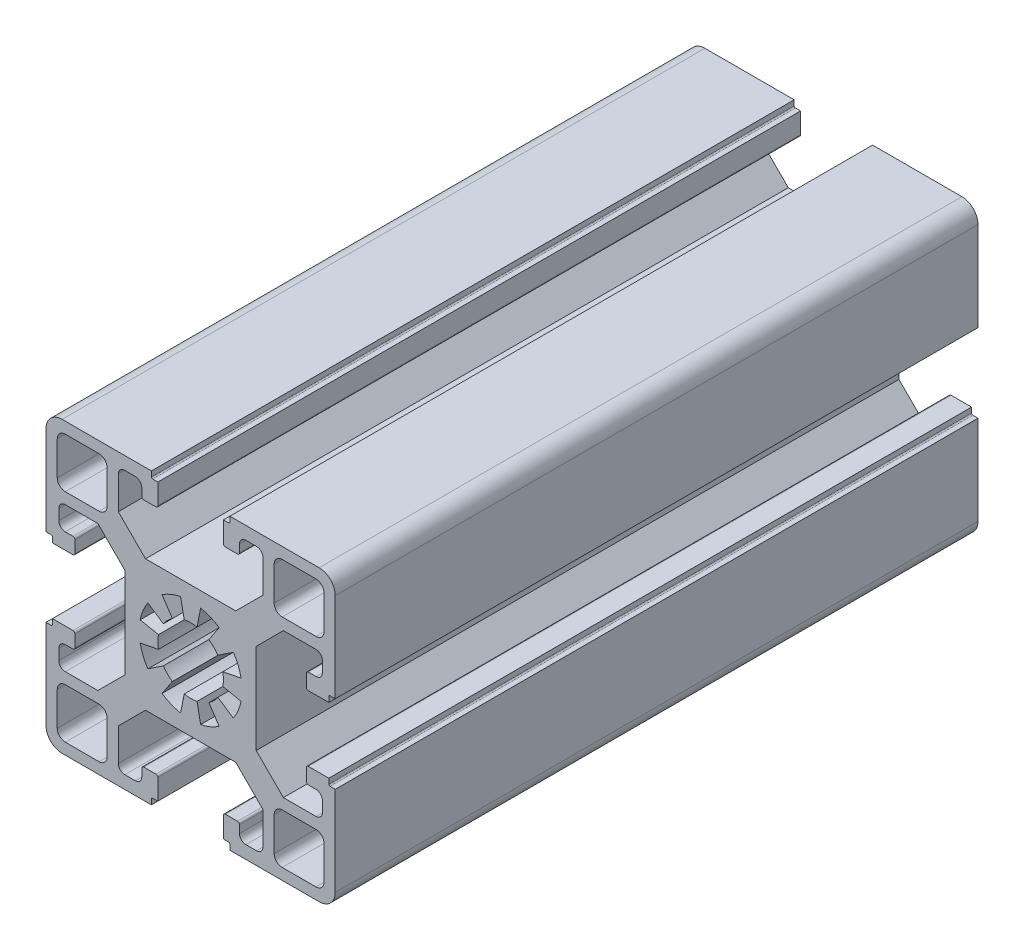
from build123d import *

# Parameters (mm, degrees)
EXTRUDE_1_DEPTH = 100


with BuildPart() as part:
    # 草图1 → 凸台-拉伸1 (new body)
    with BuildSketch(Plane.XY):
        with BuildLine():
            Line((-7.794028247, 21.742987377), (-21.694028247, 21.742987377))
            ThreePointArc((-21.694028247, 21.742987377), (-23.4617952, 21.01075433), (-24.194028247, 19.242987377))
            Line((-24.194028247, 19.242987377), (-24.194028247, 5.342987377))
            Line((-24.194028247, 5.342987377), (-23.394028247, 5.342987377))
            ThreePointArc((-23.394028247, 5.342987377), (-23.252606891, 5.284408734), (-23.194028247, 5.142987377))
            Line((-23.194028247, 5.142987377), (-23.194028247, 4.342987377))
            Line((-23.194028247, 4.342987377), (-19.994028247, 4.342987377))
            ThreePointArc((-19.994028247, 4.342987377), (-19.781896213, 4.430855343), (-19.694028247, 4.642987377))
            Line((-19.694028247, 4.642987377), (-19.694028247, 6.542987377))
            ThreePointArc((-19.694028247, 6.542987377), (-19.781896213, 6.755119412), (-19.994028247, 6.842987377))
            Line((-19.994028247, 6.842987377), (-21.194028247, 6.842987377))
            ThreePointArc((-21.194028247, 6.842987377), (-21.901135028, 7.135880596), (-22.194028247, 7.842987377))
            Line((-22.194028247, 7.842987377), (-22.194028247, 9.492987377))
            ThreePointArc((-22.194028247, 9.492987377), (-21.901135028, 10.200094158), (-21.194028247, 10.492987377))
            Line((-21.194028247, 10.492987377), (-16.126008762, 10.492987377))
            Line((-16.126008762, 10.492987377), (-11.894028247, 6.261006862))
            Line((-11.894028247, 6.261006862), (-11.894028247, -7.775032107))
            Line((-11.894028247, -7.775032107), (-16.126008762, -12.007012623))
            Line((-16.126008762, -12.007012623), (-21.194028247, -12.007012623))
            ThreePointArc((-21.194028247, -12.007012623), (-21.901135028, -11.714119404), (-22.194028247, -11.007012623))
            Line((-22.194028247, -11.007012623), (-22.194028247, -9.357012623))
            ThreePointArc((-22.194028247, -9.357012623), (-21.901135028, -8.649905842), (-21.194028247, -8.357012623))
            Line((-21.194028247, -8.357012623), (-19.994028247, -8.357012623))
            ThreePointArc((-19.994028247, -8.357012623), (-19.781896213, -8.269144657), (-19.694028247, -8.057012623))
            Line((-19.694028247, -8.057012623), (-19.694028247, -6.157012623))
            ThreePointArc((-19.694028247, -6.157012623), (-19.781896213, -5.944880588), (-19.994028247, -5.857012623))
            Line((-19.994028247, -5.857012623), (-23.194028247, -5.857012623))
            Line((-23.194028247, -5.857012623), (-23.194028247, -6.657012623))
            ThreePointArc((-23.194028247, -6.657012623), (-23.252606891, -6.798433979), (-23.394028247, -6.857012623))
            Line((-23.394028247, -6.857012623), (-24.194028247, -6.857012623))
            Line((-24.194028247, -6.857012623), (-24.194028247, -20.757012623))
            ThreePointArc((-24.194028247, -20.757012623), (-23.4617952, -22.524779576), (-21.694028247, -23.257012623))
            Line((-21.694028247, -23.257012623), (-7.794028247, -23.257012623))
            Line((-7.794028247, -23.257012623), (-7.794028247, -22.457012623))
            ThreePointArc((-7.794028247, -22.457012623), (-7.735449603, -22.315591266), (-7.594028247, -22.257012623))
            Line((-7.594028247, -22.257012623), (-6.794028247, -22.257012623))
            Line((-6.794028247, -22.257012623), (-6.794028247, -19.057012623))
            ThreePointArc((-6.794028247, -19.057012623), (-6.881896213, -18.844880588), (-7.094028247, -18.757012623))
            Line((-7.094028247, -18.757012623), (-8.994028247, -18.757012623))
            ThreePointArc((-8.994028247, -18.757012623), (-9.206160281, -18.844880588), (-9.294028247, -19.057012623))
            Line((-9.294028247, -19.057012623), (-9.294028247, -20.257012623))
            ThreePointArc((-9.294028247, -20.257012623), (-9.586921466, -20.964119404), (-10.294028247, -21.257012623))
            Line((-10.294028247, -21.257012623), (-11.944028247, -21.257012623))
            ThreePointArc((-11.944028247, -21.257012623), (-12.651135028, -20.964119404), (-12.944028247, -20.257012623))
            Line((-12.944028247, -20.257012623), (-12.944028247, -15.188993138))
            Line((-12.944028247, -15.188993138), (-8.712047732, -10.957012623))
            Line((-8.712047732, -10.957012623), (5.323991238, -10.957012623))
            Line((5.323991238, -10.957012623), (9.555971753, -15.188993138))
            Line((9.555971753, -15.188993138), (9.555971753, -20.257012623))
            ThreePointArc((9.555971753, -20.257012623), (9.263078534, -20.964119404), (8.555971753, -21.257012623))
            Line((8.555971753, -21.257012623), (6.905971753, -21.257012623))
            ThreePointArc((6.905971753, -21.257012623), (6.198864972, -20.964119404), (5.905971753, -20.257012623))
            Line((5.905971753, -20.257012623), (5.905971753, -19.057012623))
            ThreePointArc((5.905971753, -19.057012623), (5.818103787, -18.844880588), (5.605971753, -18.757012623))
            Line((5.605971753, -18.757012623), (3.705971753, -18.757012623))
            ThreePointArc((3.705971753, -18.757012623), (3.493839719, -18.844880588), (3.405971753, -19.057012623))
            Line((3.405971753, -19.057012623), (3.405971753, -22.257012623))
            Line((3.405971753, -22.257012623), (4.205971753, -22.257012623))
            ThreePointArc((4.205971753, -22.257012623), (4.347393109, -22.315591266), (4.405971753, -22.457012623))
            Line((4.405971753, -22.457012623), (4.405971753, -23.257012623))
            Line((4.405971753, -23.257012623), (18.305971753, -23.257012623))
            ThreePointArc((18.305971753, -23.257012623), (20.073738706, -22.524779576), (20.805971753, -20.757012623))
            Line((20.805971753, -20.757012623), (20.805971753, -6.857012623))
            Line((20.805971753, -6.857012623), (20.005971753, -6.857012623))
            ThreePointArc((20.005971753, -6.857012623), (19.864550397, -6.798433979), (19.805971753, -6.657012623))
            Line((19.805971753, -6.657012623), (19.805971753, -5.857012623))
            Line((19.805971753, -5.857012623), (16.605971753, -5.857012623))
            ThreePointArc((16.605971753, -5.857012623), (16.393839719, -5.944880588), (16.305971753, -6.157012623))
            Line((16.305971753, -6.157012623), (16.305971753, -8.057012623))
            ThreePointArc((16.305971753, -8.057012623), (16.393839719, -8.269144657), (16.605971753, -8.357012623))
            Line((16.605971753, -8.357012623), (17.805971753, -8.357012623))
            ThreePointArc((17.805971753, -8.357012623), (18.513078534, -8.649905842), (18.805971753, -9.357012623))
            Line((18.805971753, -9.357012623), (18.805971753, -11.007012623))
            ThreePointArc((18.805971753, -11.007012623), (18.513078534, -11.714119404), (17.805971753, -12.007012623))
            Line((17.805971753, -12.007012623), (12.737952268, -12.007012623))
            Line((12.737952268, -12.007012623), (8.505971753, -7.775032107))
            Line((8.505971753, -7.775032107), (8.505971753, 6.261006862))
            Line((8.505971753, 6.261006862), (12.737952268, 10.492987377))
            Line((12.737952268, 10.492987377), (17.805971753, 10.492987377))
            ThreePointArc((17.805971753, 10.492987377), (18.513078534, 10.200094158), (18.805971753, 9.492987377))
            Line((18.805971753, 9.492987377), (18.805971753, 7.842987377))
            ThreePointArc((18.805971753, 7.842987377), (18.513078534, 7.135880596), (17.805971753, 6.842987377))
            Line((17.805971753, 6.842987377), (16.605971753, 6.842987377))
            ThreePointArc((16.605971753, 6.842987377), (16.393839719, 6.755119412), (16.305971753, 6.542987377))
            Line((16.305971753, 6.542987377), (16.305971753, 4.642987377))
            ThreePointArc((16.305971753, 4.642987377), (16.393839719, 4.430855343), (16.605971753, 4.342987377))
            Line((16.605971753, 4.342987377), (19.805971753, 4.342987377))
            Line((19.805971753, 4.342987377), (19.805971753, 5.142987377))
            ThreePointArc((19.805971753, 5.142987377), (19.864550397, 5.284408734), (20.005971753, 5.342987377))
            Line((20.005971753, 5.342987377), (20.805971753, 5.342987377))
            Line((20.805971753, 5.342987377), (20.805971753, 19.242987377))
            ThreePointArc((20.805971753, 19.242987377), (20.073738706, 21.01075433), (18.305971753, 21.742987377))
            Line((18.305971753, 21.742987377), (4.405971753, 21.742987377))
            Line((4.405971753, 21.742987377), (4.405971753, 20.942987377))
            ThreePointArc((4.405971753, 20.942987377), (4.347393109, 20.801566021), (4.205971753, 20.742987377))
            Line((4.205971753, 20.742987377), (3.405971753, 20.742987377))
            Line((3.405971753, 20.742987377), (3.405971753, 17.542987377))
            ThreePointArc((3.405971753, 17.542987377), (3.493839719, 17.330855343), (3.705971753, 17.242987377))
            Line((3.705971753, 17.242987377), (5.605971753, 17.242987377))
            ThreePointArc((5.605971753, 17.242987377), (5.818103787, 17.330855343), (5.905971753, 17.542987377))
            Line((5.905971753, 17.542987377), (5.905971753, 18.742987377))
            ThreePointArc((5.905971753, 18.742987377), (6.198864972, 19.450094158), (6.905971753, 19.742987377))
            Line((6.905971753, 19.742987377), (8.555971753, 19.742987377))
            ThreePointArc((8.555971753, 19.742987377), (9.263078534, 19.450094158), (9.555971753, 18.742987377))
            Line((9.555971753, 18.742987377), (9.555971753, 13.674967893))
            Line((9.555971753, 13.674967893), (5.323991238, 9.442987377))
            Line((5.323991238, 9.442987377), (-8.712047732, 9.442987377))
            Line((-8.712047732, 9.442987377), (-12.944028247, 13.674967893))
            Line((-12.944028247, 13.674967893), (-12.944028247, 18.742987377))
            ThreePointArc((-12.944028247, 18.742987377), (-12.651135028, 19.450094158), (-11.944028247, 19.742987377))
            Line((-11.944028247, 19.742987377), (-10.294028247, 19.742987377))
            ThreePointArc((-10.294028247, 19.742987377), (-9.586921466, 19.450094158), (-9.294028247, 18.742987377))
            Line((-9.294028247, 18.742987377), (-9.294028247, 17.542987377))
            ThreePointArc((-9.294028247, 17.542987377), (-9.206160281, 17.330855343), (-8.994028247, 17.242987377))
            Line((-8.994028247, 17.242987377), (-7.094028247, 17.242987377))
            ThreePointArc((-7.094028247, 17.242987377), (-6.881896213, 17.330855343), (-6.794028247, 17.542987377))
            Line((-6.794028247, 17.542987377), (-6.794028247, 20.742987377))
            Line((-6.794028247, 20.742987377), (-7.594028247, 20.742987377))
            ThreePointArc((-7.594028247, 20.742987377), (-7.735449603, 20.801566021), (-7.794028247, 20.942987377))
            Line((-7.794028247, 20.942987377), (-7.794028247, 21.742987377))
        make_face()
        with BuildLine():
            Line((-21.194028247, 12.242987377), (-15.944028247, 12.242987377))
            ThreePointArc((-15.944028247, 12.242987377), (-15.06014477, 12.609103901), (-14.694028247, 13.492987377))
            Line((-14.694028247, 13.492987377), (-14.694028247, 18.742987377))
            ThreePointArc((-14.694028247, 18.742987377), (-15.06014477, 19.626870854), (-15.944028247, 19.992987377))
            Line((-15.944028247, 19.992987377), (-21.194028247, 19.992987377))
            ThreePointArc((-21.194028247, 19.992987377), (-22.077911723, 19.626870854), (-22.444028247, 18.742987377))
            Line((-22.444028247, 18.742987377), (-22.444028247, 13.492987377))
            ThreePointArc((-22.444028247, 13.492987377), (-22.077911723, 12.609103901), (-21.194028247, 12.242987377))
        make_face(mode=Mode.SUBTRACT)
        with BuildLine():
            Line((17.805971753, 12.242987377), (12.555971753, 12.242987377))
            ThreePointArc((12.555971753, 12.242987377), (11.672088277, 12.609103901), (11.305971753, 13.492987377))
            Line((11.305971753, 13.492987377), (11.305971753, 18.742987377))
            ThreePointArc((11.305971753, 18.742987377), (11.672088277, 19.626870854), (12.555971753, 19.992987377))
            Line((12.555971753, 19.992987377), (17.805971753, 19.992987377))
            ThreePointArc((17.805971753, 19.992987377), (18.68985523, 19.626870854), (19.055971753, 18.742987377))
            Line((19.055971753, 18.742987377), (19.055971753, 13.492987377))
            ThreePointArc((19.055971753, 13.492987377), (18.68985523, 12.609103901), (17.805971753, 12.242987377))
        make_face(mode=Mode.SUBTRACT)
        with BuildLine():
            Line((-21.194028247, -13.757012623), (-15.944028247, -13.757012623))
            ThreePointArc((-15.944028247, -13.757012623), (-15.06014477, -14.123129146), (-14.694028247, -15.007012623))
            Line((-14.694028247, -15.007012623), (-14.694028247, -20.257012623))
            ThreePointArc((-14.694028247, -20.257012623), (-15.06014477, -21.140896099), (-15.944028247, -21.507012623))
            Line((-15.944028247, -21.507012623), (-21.194028247, -21.507012623))
            ThreePointArc((-21.194028247, -21.507012623), (-22.077911723, -21.140896099), (-22.444028247, -20.257012623))
            Line((-22.444028247, -20.257012623), (-22.444028247, -15.007012623))
            ThreePointArc((-22.444028247, -15.007012623), (-22.077911723, -14.123129146), (-21.194028247, -13.757012623))
        make_face(mode=Mode.SUBTRACT)
        with BuildLine():
            Line((17.805971753, -13.757012623), (12.555971753, -13.757012623))
            ThreePointArc((12.555971753, -13.757012623), (11.672088277, -14.123129146), (11.305971753, -15.007012623))
            Line((11.305971753, -15.007012623), (11.305971753, -20.257012623))
            ThreePointArc((11.305971753, -20.257012623), (11.672088277, -21.140896099), (12.555971753, -21.507012623))
            Line((12.555971753, -21.507012623), (17.805971753, -21.507012623))
            ThreePointArc((17.805971753, -21.507012623), (18.68985523, -21.140896099), (19.055971753, -20.257012623))
            Line((19.055971753, -20.257012623), (19.055971753, -15.007012623))
            ThreePointArc((19.055971753, -15.007012623), (18.68985523, -14.123129146), (17.805971753, -13.757012623))
        make_face(mode=Mode.SUBTRACT)
        with BuildLine():
            Line((-6.138590111, -7.408769521), (-4.527436435, -4.997507645))
            ThreePointArc((-4.527436435, -4.997507645), (-5.300272831, -4.363257207), (-5.93452327, -3.590420811))
            Line((-5.93452327, -3.590420811), (-8.345785145, -5.201574487))
            ThreePointArc((-8.345785145, -5.201574487), (-9.085064507, -3.818480082), (-9.54031049, -2.317735199))
            Line((-9.54031049, -2.317735199), (-6.696033177, -1.751973265))
            ThreePointArc((-6.696033177, -1.751973265), (-6.794028247, -0.757012623), (-6.696033177, 0.23794802))
            Line((-6.696033177, 0.23794802), (-9.54031049, 0.803709953))
            ThreePointArc((-9.54031049, 0.803709953), (-9.085064507, 2.304454836), (-8.345785145, 3.687549241))
            Line((-8.345785145, 3.687549241), (-5.93452327, 2.076395566))
            ThreePointArc((-5.93452327, 2.076395566), (-5.300272831, 2.849231961), (-4.527436435, 3.4834824))
            Line((-4.527436435, 3.4834824), (-6.138590111, 5.894744276))
            ThreePointArc((-6.138590111, 5.894744276), (-4.755495706, 6.634023637), (-3.254750823, 7.089269621))
            Line((-3.254750823, 7.089269621), (-2.688988889, 4.244992307))
            ThreePointArc((-2.688988889, 4.244992307), (-1.694028247, 4.342987377), (-0.699067605, 4.244992307))
            Line((-0.699067605, 4.244992307), (-0.133305671, 7.089269621))
            ThreePointArc((-0.133305671, 7.089269621), (1.367439212, 6.634023637), (2.750533617, 5.894744276))
            Line((2.750533617, 5.894744276), (1.139379942, 3.4834824))
            ThreePointArc((1.139379942, 3.4834824), (1.912216337, 2.849231961), (2.546466776, 2.076395566))
            Line((2.546466776, 2.076395566), (4.957728652, 3.687549241))
            ThreePointArc((4.957728652, 3.687549241), (5.697008013, 2.304454836), (6.152253996, 0.803709953))
            Line((6.152253996, 0.803709953), (3.307976683, 0.23794802))
            ThreePointArc((3.307976683, 0.23794802), (3.405971753, -0.757012623), (3.307976683, -1.751973265))
            Line((3.307976683, -1.751973265), (6.152253996, -2.317735199))
            ThreePointArc((6.152253996, -2.317735199), (5.697008013, -3.818480082), (4.957728652, -5.201574487))
            Line((4.957728652, -5.201574487), (2.546466776, -3.590420811))
            ThreePointArc((2.546466776, -3.590420811), (1.912216337, -4.363257207), (1.139379942, -4.997507645))
            Line((1.139379942, -4.997507645), (2.750533617, -7.408769521))
            ThreePointArc((2.750533617, -7.408769521), (1.367439212, -8.148048883), (-0.133305671, -8.603294866))
            Line((-0.133305671, -8.603294866), (-0.699067605, -5.759017553))
            ThreePointArc((-0.699067605, -5.759017553), (-1.694028247, -5.857012623), (-2.688988889, -5.759017553))
            Line((-2.688988889, -5.759017553), (-3.254750823, -8.603294866))
            ThreePointArc((-3.254750823, -8.603294866), (-4.755495706, -8.148048883), (-6.138590111, -7.408769521))
        make_face(mode=Mode.SUBTRACT)
    extrude(amount=EXTRUDE_1_DEPTH)


solid = part.part
